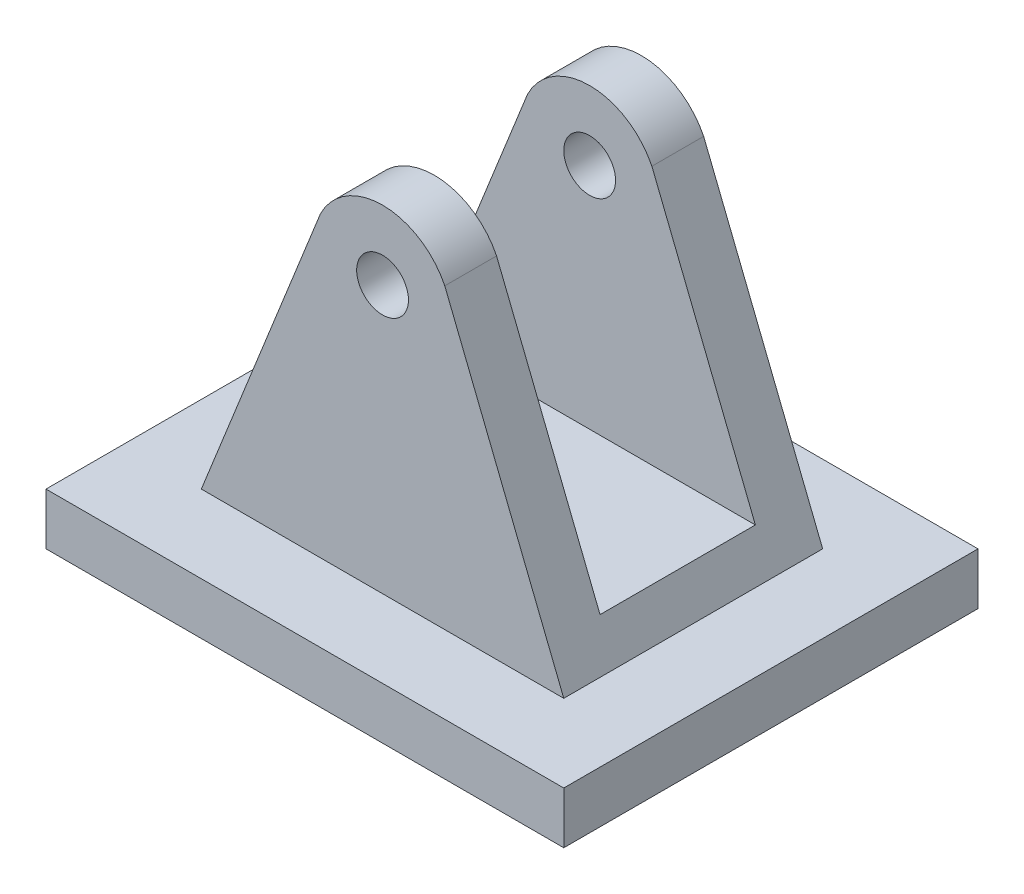
from build123d import *

# Parameters (mm, degrees)
SKETCH1_W           = 100
SKETCH1_H           = 80
BOSS_EXTRUDE1_DEPTH = 10
SKETCH2_W           = 70
SKETCH2_H           = 50
BOSS_EXTRUDE2_DEPTH = 65
CUT_EXTRUDE2_DEPTH  = 94
SKETCH3_R           = 5
CUT_EXTRUDE4_DEPTH  = 94


with BuildPart() as part:
    # Sketch1 → Boss-Extrude1 (new body)
    with BuildSketch(Plane(origin=(0, 0, 0), x_dir=(1, 0, 0), z_dir=(0, 1, 0))):
        with Locations((-19.281045752, -3.071895425)):
            Rectangle(SKETCH1_W, SKETCH1_H)
    extrude(amount=BOSS_EXTRUDE1_DEPTH)

    # Sketch2 → Boss-Extrude2 (add)
    with BuildSketch(Plane(origin=(0, 10, 0), x_dir=(1, 0, 0), z_dir=(0, 1, 0))):
        with Locations((-19.281045752, -3.071895425)):
            Rectangle(SKETCH2_W, SKETCH2_H)
    extrude(amount=BOSS_EXTRUDE2_DEPTH)

    # Sketch5 → Cut-Extrude2 (cut)
    with BuildSketch(Plane(origin=(15.718954248, 0, 0), x_dir=(0, 0, -1), z_dir=(1, 0, 0))):
        Polygon((11.928104575, 17.5), (-18.071895425, 17.5), (-18.071895425, 67.5), (-18.071895425, 75), (11.928104575, 75), (11.928104575, 67.5), align=None)
    extrude(amount=-CUT_EXTRUDE2_DEPTH, mode=Mode.SUBTRACT)

    # Sketch3 → Cut-Extrude4 (cut)
    with BuildSketch(Plane.XY.offset(28.071895425)):
        Polygon((-54.281045752, 75), (-54.281045752, 10), (-31.2976006, 67.501159063), (-28.300283638, 75), align=None)
        with BuildLine():
            Line((-28.300283638, 75), (-31.2976006, 67.501159063))
            ThreePointArc((-31.2976006, 67.501159063), (-26.363245371, 72.97149148), (-19.281045752, 75))
            Line((-19.281045752, 75), (-28.300283638, 75))
        make_face()
        with BuildLine():
            Line((-10.261807865, 75), (-19.281045752, 75))
            ThreePointArc((-19.281045752, 75), (-12.198846132, 72.97149148), (-7.264490904, 67.501159063))
            Line((-7.264490904, 67.501159063), (-10.261807865, 75))
        make_face()
        Polygon((-10.261807865, 75), (-7.264490904, 67.501159063), (15.718954248, 10), (15.718954248, 75), align=None)
        with Locations((-19.281045752, 61.622585577)):
            Circle(SKETCH3_R)
    extrude(amount=-CUT_EXTRUDE4_DEPTH, mode=Mode.SUBTRACT)


solid = part.part
